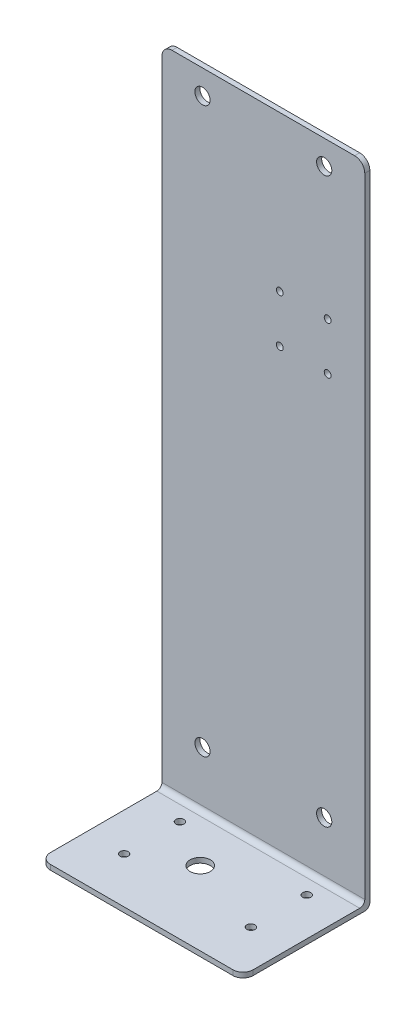
from build123d import *

# Parameters (mm, degrees)
SKETCH2_W           = 127
SKETCH2_H           = 406.4
BOSS_EXTRUDE1_DEPTH = 3.175
SKETCH3_W           = 127
SKETCH3_H           = 3.175
BOSS_EXTRUDE2_DEPTH = 76.2
FILLET1_R           = 3.175
FILLET2_R           = 6.35
SKETCH4_R           = 6.35
SKETCH4_R_2         = 2.54
CUT_EXTRUDE1_DEPTH  = 416.840163104
SKETCH5_R           = 2.15
SKETCH5_R_2         = 4.7625
CUT_EXTRUDE2_DEPTH  = 227.117071448


with BuildPart() as part:
    # Sketch2 → Boss-Extrude1 (new body)
    with BuildSketch(Plane.XY):
        Rectangle(SKETCH2_W, SKETCH2_H)
    extrude(amount=BOSS_EXTRUDE1_DEPTH)

    # Sketch3 → Boss-Extrude2 (add)
    with BuildSketch(Plane.XY.offset(3.175)):
        with Locations((0, -201.6125)):
            Rectangle(SKETCH3_W, SKETCH3_H)
    extrude(amount=BOSS_EXTRUDE2_DEPTH)

    # Fillet1
    fillet1_edges = [part.edges().sort_by_distance(p)[0] for p in [
        (0, -200.025, 3.175),
        (0, -203.2, 0),
    ]]
    fillet(fillet1_edges, radius=FILLET1_R)

    # Fillet2
    fillet2_edges = [part.edges().sort_by_distance(p)[0] for p in [
        (-63.5, -201.6125, 79.375),
        (63.5, -201.6125, 79.375),
        (-63.5, 203.2, 1.5875),
        (63.5, 203.2, 1.5875),
    ]]
    fillet(fillet2_edges, radius=FILLET2_R)

    # Sketch4 → Cut-Extrude1 (cut, through all)
    with BuildSketch(Plane(origin=(0, -200.025, 0), x_dir=(1, 0, 0), z_dir=(0, 1, 0))):
        with Locations(Location((-9.525, -33.175, 0), (0, 0, 270))):
            Circle(SKETCH4_R)
        with Locations(Location((-39.6875, -15.7125, 0), (0, 0, 270))):
            Circle(SKETCH4_R_2)
        with Locations(Location((-39.6875, -50.6375, 0), (0, 0, 270))):
            Circle(SKETCH4_R_2)
        with Locations(Location((39.6875, -15.7125, 0), (0, 0, 270))):
            Circle(SKETCH4_R_2)
        with Locations(Location((39.6875, -50.6375, 0), (0, 0, 270))):
            Circle(SKETCH4_R_2)
    extrude(amount=-CUT_EXTRUDE1_DEPTH, mode=Mode.SUBTRACT)

    # Sketch5 → Cut-Extrude2 (cut, through all)
    with BuildSketch(Plane.XY.offset(3.175)):
        with Locations((10.273, 76.475)):
            Circle(SKETCH5_R)
        with Locations((40.273, 76.475)):
            Circle(SKETCH5_R)
        with Locations((40.273, 106.175)):
            Circle(SKETCH5_R)
        with Locations((10.273, 106.175)):
            Circle(SKETCH5_R)
        with Locations((-38.1, 187.96)):
            Circle(SKETCH5_R_2)
        with Locations((38.1, 187.96)):
            Circle(SKETCH5_R_2)
        with Locations((-38.1, -165.1)):
            Circle(SKETCH5_R_2)
        with Locations((38.1, -165.1)):
            Circle(SKETCH5_R_2)
    extrude(amount=-CUT_EXTRUDE2_DEPTH, mode=Mode.SUBTRACT)


solid = part.part
